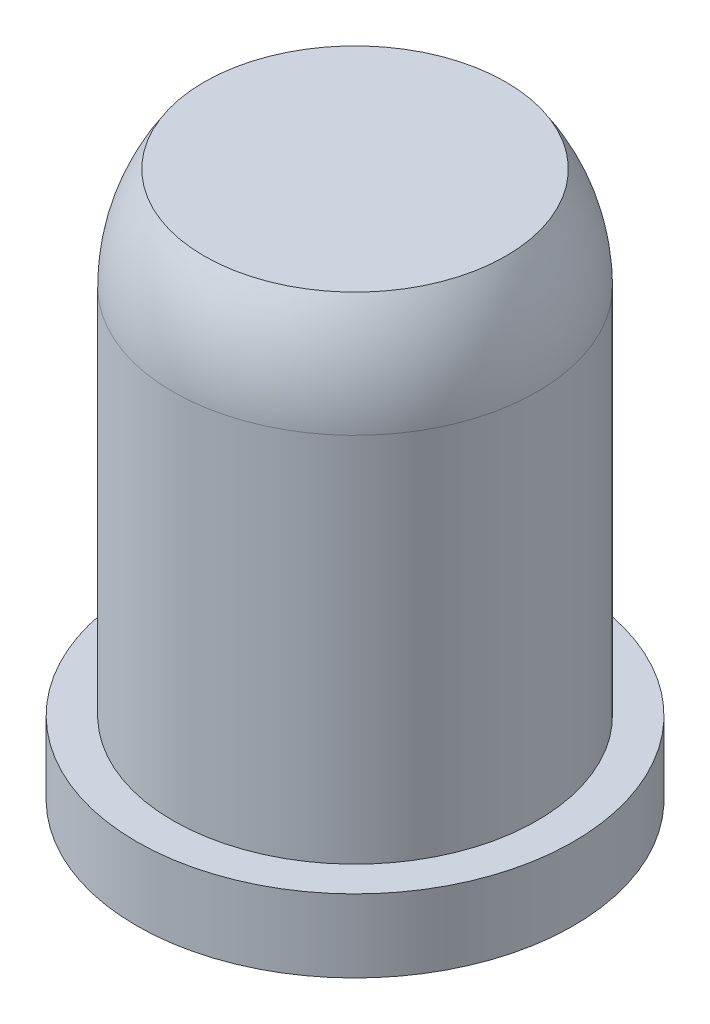
from build123d import *

# Parameters (mm, degrees)
SKETCH_1_R          = 3
EXTRUDE_1_DEPTH     = 1
SKETCH_2_R          = 2.5
EXTRUDE_2_DEPTH     = 7.6
FILLET_1_R          = 2.5
SKETCH_4_R          = 2.556662668
CUT_EXTRUDE_1_DEPTH = 1.1


with BuildPart() as part:
    # Эскиз1 → Бобышка-Вытянуть1 (new body)
    with BuildSketch(Plane(origin=(0, 0, 0), x_dir=(1, 0, 0), z_dir=(0, 1, 0))):
        with Locations(Location((0, 0, 0), (0, 0, 270))):
            Circle(SKETCH_1_R)
    extrude(amount=EXTRUDE_1_DEPTH)

    # Эскиз2 → Бобышка-Вытянуть2 (add)
    with BuildSketch(Plane(origin=(0, 1, 0), x_dir=(1, 0, 0), z_dir=(0, 1, 0))):
        with Locations(Location((0, 0, 0), (0, 0, 90))):
            Circle(SKETCH_2_R)
    extrude(amount=EXTRUDE_2_DEPTH)

    # Скругление1
    fillet_1_edges = [part.edges().sort_by_distance(p)[0] for p in [
        (0, 8.6, 2.5),
    ]]
    fillet(fillet_1_edges, radius=FILLET_1_R)

    # Эскиз4 → Вырез-Вытянуть1 (cut)
    with BuildSketch(Plane(origin=(0, 8.6, 0), x_dir=(1, 0, 0), z_dir=(0, 1, 0))):
        Circle(SKETCH_4_R)
    extrude(amount=-CUT_EXTRUDE_1_DEPTH, mode=Mode.SUBTRACT)


solid = part.part
